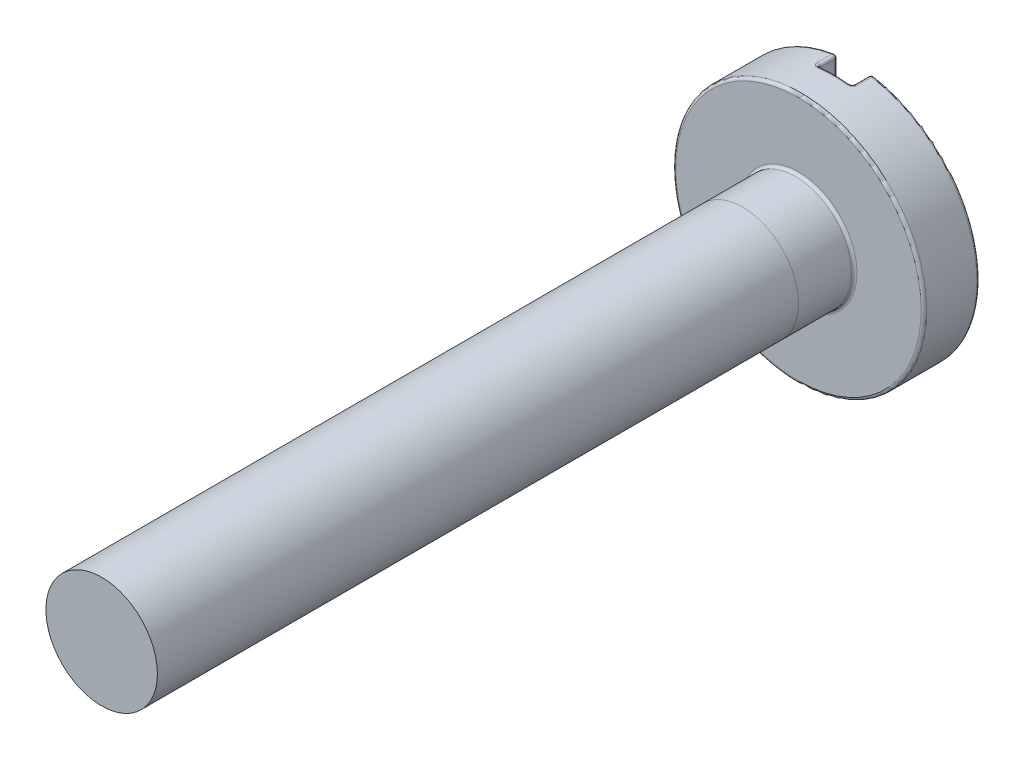
from build123d import *

# Parameters (mm, degrees)
SKETCH1_R           = 1
BOSS_EXTRUDE1_DEPTH = 12.5
SKETCH2_R           = 2.25
BOSS_EXTRUDE2_DEPTH = 1
SKETCH3_W           = 0.6
SKETCH3_H           = 13.562630166
CUT_EXTRUDE1_DEPTH  = 0.35
FILLET1_R           = 0.05
FILLET2_R           = 0.05


with BuildPart() as part:
    # Sketch1 → Boss-Extrude1 (new body)
    with BuildSketch(Plane.XY):
        Circle(SKETCH1_R)
    extrude(amount=BOSS_EXTRUDE1_DEPTH)

    # Sketch2 → Boss-Extrude2 (add)
    with BuildSketch(Plane.XY):
        Circle(SKETCH2_R)
    extrude(amount=-BOSS_EXTRUDE2_DEPTH)

    # Sketch3 → Cut-Extrude1 (cut)
    with BuildSketch(Plane(origin=(0, 0, -1), x_dir=(-1, 0, 0), z_dir=(0, 0, -1))):
        Rectangle(SKETCH3_W, SKETCH3_H)
    extrude(amount=-CUT_EXTRUDE1_DEPTH, mode=Mode.SUBTRACT)

    # Fillet1
    fillet1_edges = [part.edges().sort_by_distance(p)[0] for p in [
        (1.693738469, 1.481131324, -1),
        (-0.3, 0, -1),
        (0.3, 0, -1),
        (0, 2.25, -0.65),
        (0, -2.25, -0.65),
        (0.3, 2.229910312, -0.825),
        (0.3, -2.229910312, -0.825),
        (-0.3, -2.229910312, -0.825),
        (-0.3, 2.229910312, -0.825),
        (0.3, 0, -0.65),
        (-0.3, 0, -0.65),
        (-2.25, 0, -1),
    ]]
    fillet(fillet1_edges, radius=FILLET1_R)

    # Fillet2
    fillet2_edges = [part.edges().sort_by_distance(p)[0] for p in [
        (-1, 0, 0),
        (-2.25, 0, 0),
    ]]
    fillet(fillet2_edges, radius=FILLET2_R)


solid = part.part
